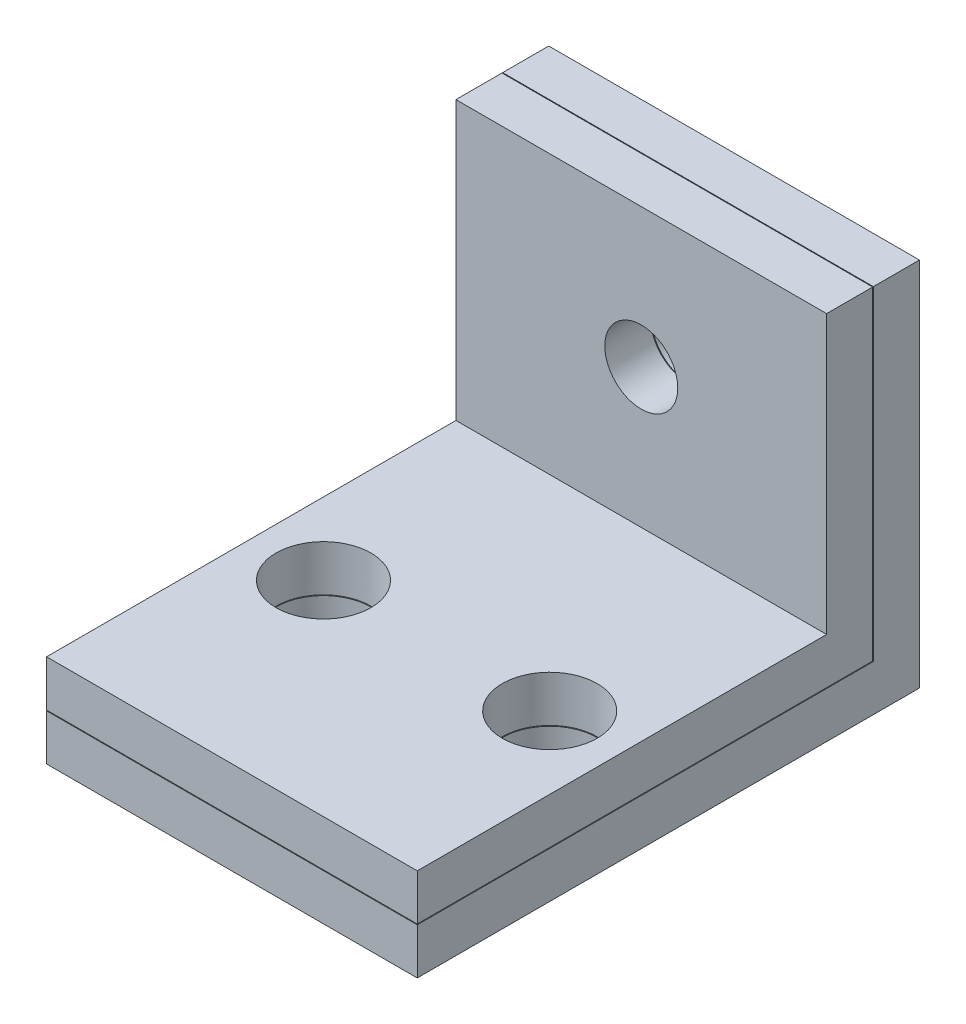
from build123d import *

# Parameters (mm, degrees)
SALIENTE_EXTRUIR1_DEPTH = 50.8
SALIENTE_EXTRUIR2_DEPTH = 50.8
CROQUIS4_R              = 6.5
CORTAR_EXTRUIR1_DEPTH   = 97.8
CROQUIS5_R              = 5
CORTAR_EXTRUIR2_DEPTH   = 22


with BuildPart() as part:
    # Croquis1 → Saliente-Extruir1 (new body)
    with BuildSketch(Plane(origin=(0, 0, 0), x_dir=(0, 0, -1), z_dir=(1, 0, 0))):
        Polygon((0, 0), (68.82, 0), (68.82, 50.8), (62.51, 50.8), (62.51, 6.31), (0, 6.31), align=None)
    extrude(amount=SALIENTE_EXTRUIR1_DEPTH)


with BuildPart() as body_2:
    # Croquis2 → Saliente-Extruir2 (new body)
    with BuildSketch(Plane(origin=(50.8, 0, 0), x_dir=(0, 0, -1), z_dir=(1, 0, 0))):
        Polygon((0, 6.41), (62.41, 6.41), (62.41, 50.8), (56.1, 50.8), (56.1, 12.72), (0, 12.72), align=None)
    extrude(amount=-SALIENTE_EXTRUIR2_DEPTH)


with BuildPart() as cortar_extruir1_tool:
    # Croquis4 → Cortar-Extruir1 (new body)
    with BuildSketch(Plane(origin=(0, 12.72, 0), x_dir=(1, 0, 0), z_dir=(0, 1, 0))):
        with Locations(Location((9.9, 28.05, 0), (0, 0, 270))):
            Circle(CROQUIS4_R)
        with Locations(Location((40.9, 28.05, 0), (0, 0, 270))):
            Circle(CROQUIS4_R)
    extrude(amount=-CORTAR_EXTRUIR1_DEPTH)


with BuildPart() as part_1:
    add(part.part)

    # Cortar-Extruir1: cut by cortar_extruir1_tool
    add(cortar_extruir1_tool.part, mode=Mode.SUBTRACT)


with BuildPart() as body_2_1:
    add(body_2.part)

    # Cortar-Extruir1: cut by cortar_extruir1_tool
    add(cortar_extruir1_tool.part, mode=Mode.SUBTRACT)


with BuildPart() as cortar_extruir2_tool:
    # Croquis5 → Cortar-Extruir2 (new body)
    with BuildSketch(Plane.XY.offset(-56.1)):
        with Locations((25.4, 31.76)):
            Circle(CROQUIS5_R)
    extrude(amount=-CORTAR_EXTRUIR2_DEPTH)


with BuildPart() as part_2:
    add(part_1.part)

    # Cortar-Extruir2: cut by cortar_extruir2_tool
    add(cortar_extruir2_tool.part, mode=Mode.SUBTRACT)


with BuildPart() as body_2_2:
    add(body_2_1.part)

    # Cortar-Extruir2: cut by cortar_extruir2_tool
    add(cortar_extruir2_tool.part, mode=Mode.SUBTRACT)


solid = Compound([part_2.part, body_2_2.part])
